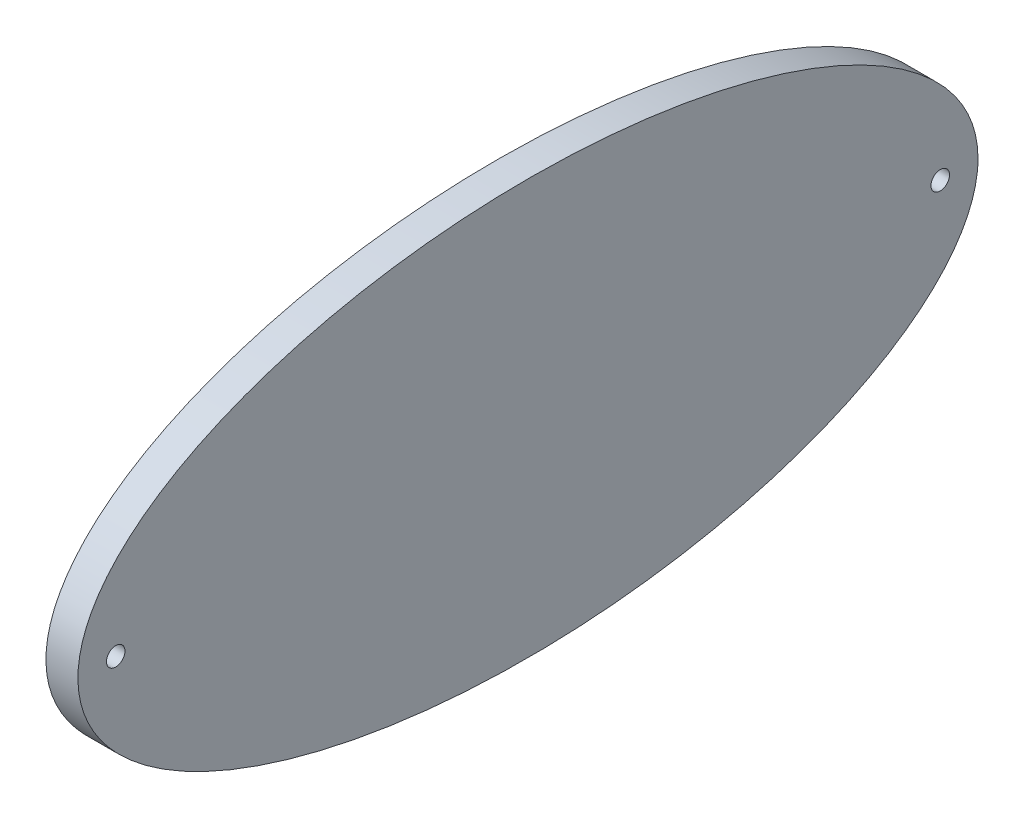
from build123d import *

# Parameters (mm, degrees)
SKETCH1_RX          = 71.5
SKETCH1_RY          = 32.95
SKETCH1_R           = 1.4732
BOSS_EXTRUDE1_DEPTH = 5.08


with BuildPart() as part:
    # Sketch1 → Boss-Extrude1 (new body)
    with BuildSketch(Plane(origin=(0, 0, 0), x_dir=(0, 0, -1), z_dir=(1, 0, 0))):
        with Locations((0, 0)):
            Ellipse(SKETCH1_RX, SKETCH1_RY)
        with Locations((-65.5, 0)):
            Circle(SKETCH1_R, mode=Mode.SUBTRACT)
        with Locations((65.5, 0)):
            Circle(SKETCH1_R, mode=Mode.SUBTRACT)
    extrude(amount=BOSS_EXTRUDE1_DEPTH)


solid = part.part
